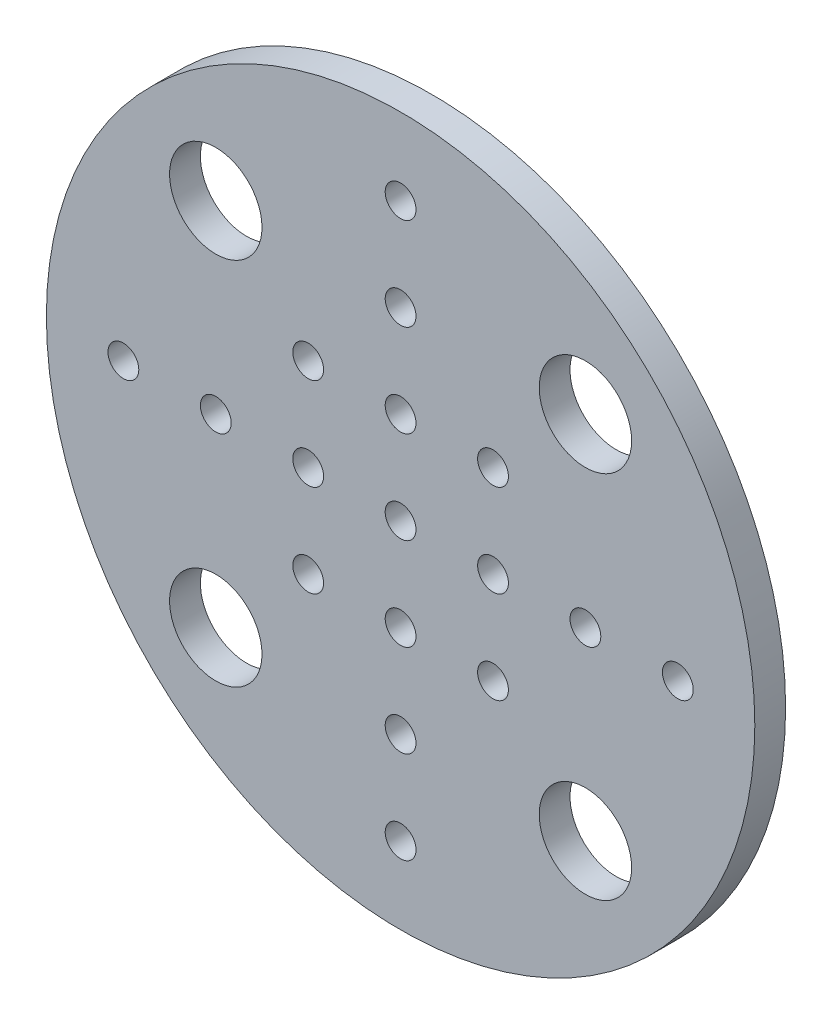
from build123d import *

# Parameters (mm, degrees)
MODEL_R                 = 34.5
MODEL_R_2               = 4.5
MODEL_R_3               = 1.5
SALIENTE_EXTRUIR1_DEPTH = 3


with BuildPart() as part:
    # Model → Saliente-Extruir1 (new body)
    with BuildSketch(Plane.XY):
        with Locations((299.518754002, 285.878815596)):
            Circle(MODEL_R)
        with Locations((281.518754002, 303.878815596)):
            Circle(MODEL_R_2, mode=Mode.SUBTRACT)
        with Locations((281.518754002, 267.878815596)):
            Circle(MODEL_R_2, mode=Mode.SUBTRACT)
        with Locations((317.518754002, 267.878815596)):
            Circle(MODEL_R_2, mode=Mode.SUBTRACT)
        with Locations((317.518754002, 303.878815596)):
            Circle(MODEL_R_2, mode=Mode.SUBTRACT)
        with Locations((299.518754002, 285.878815596)):
            Circle(MODEL_R_3, mode=Mode.SUBTRACT)
        with Locations((299.518754002, 276.878815596)):
            Circle(MODEL_R_3, mode=Mode.SUBTRACT)
        with Locations((299.518754002, 294.878815596)):
            Circle(MODEL_R_3, mode=Mode.SUBTRACT)
        with Locations((308.518754003, 285.878815596)):
            Circle(MODEL_R_3, mode=Mode.SUBTRACT)
        with Locations((290.518754002, 285.878815596)):
            Circle(MODEL_R_3, mode=Mode.SUBTRACT)
        with Locations((317.518754002, 285.878815596)):
            Circle(MODEL_R_3, mode=Mode.SUBTRACT)
        with Locations((326.518754002, 285.878815596)):
            Circle(MODEL_R_3, mode=Mode.SUBTRACT)
        with Locations((272.518754002, 285.878815596)):
            Circle(MODEL_R_3, mode=Mode.SUBTRACT)
        with Locations((281.518754002, 285.878815596)):
            Circle(MODEL_R_3, mode=Mode.SUBTRACT)
        with Locations((299.518754002, 303.878815596)):
            Circle(MODEL_R_3, mode=Mode.SUBTRACT)
        with Locations((299.518754002, 312.878815596)):
            Circle(MODEL_R_3, mode=Mode.SUBTRACT)
        with Locations((299.518754002, 267.878815596)):
            Circle(MODEL_R_3, mode=Mode.SUBTRACT)
        with Locations((299.518754002, 258.878815596)):
            Circle(MODEL_R_3, mode=Mode.SUBTRACT)
        with Locations((290.518754002, 276.878815596)):
            Circle(MODEL_R_3, mode=Mode.SUBTRACT)
        with Locations((308.518754003, 294.878815596)):
            Circle(MODEL_R_3, mode=Mode.SUBTRACT)
        with Locations((308.518754003, 276.878815596)):
            Circle(MODEL_R_3, mode=Mode.SUBTRACT)
        with Locations((290.518754002, 294.878815596)):
            Circle(MODEL_R_3, mode=Mode.SUBTRACT)
    extrude(amount=SALIENTE_EXTRUIR1_DEPTH)


solid = part.part
